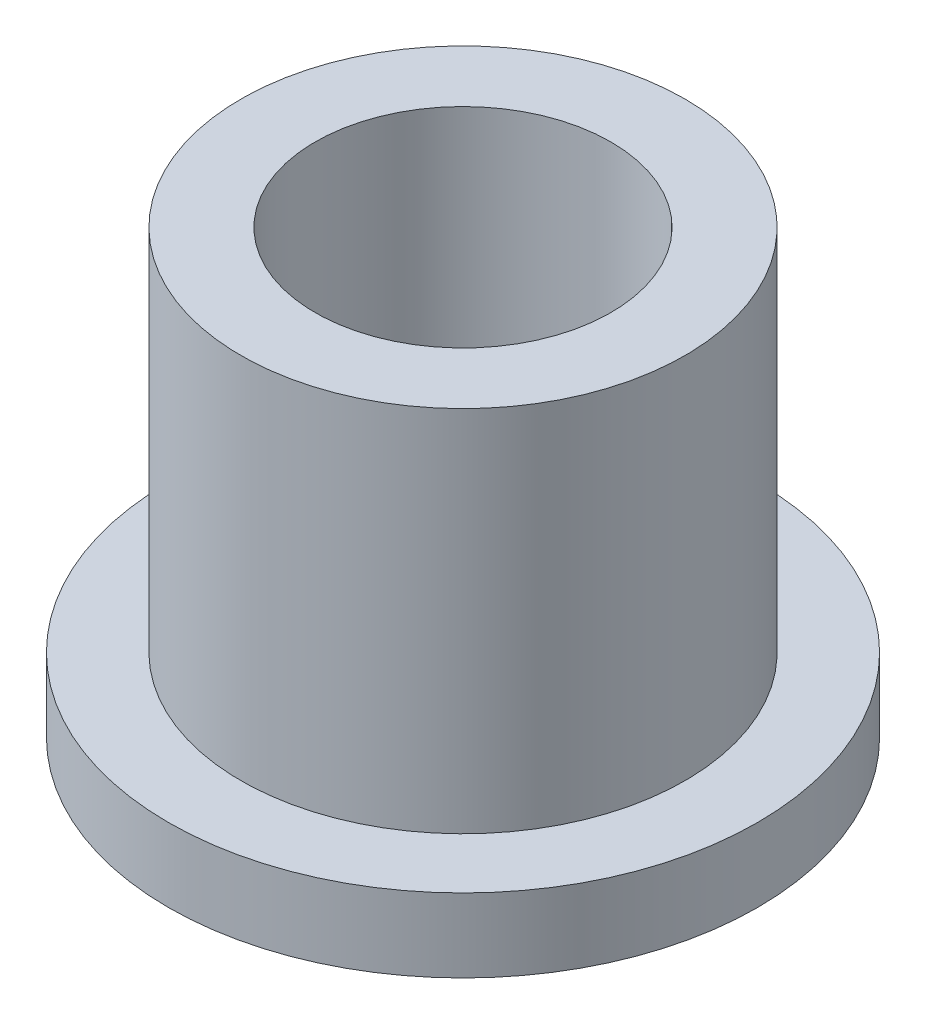
from build123d import *

# Parameters (mm, degrees)
SKETCH2_R           = 4.7879
SKETCH2_R_2         = 3.1877
BOSS_EXTRUDE1_DEPTH = 9.525
SKETCH3_R           = 6.35
SKETCH3_R_2         = 4.7879
BOSS_EXTRUDE2_DEPTH = 1.5875


with BuildPart() as part:
    # Sketch2 → Boss-Extrude1 (new body)
    with BuildSketch(Plane(origin=(0, 0, 0), x_dir=(1, 0, 0), z_dir=(0, 1, 0))):
        with Locations(Location((0, 0, 0), (0, 0, 90))):
            Circle(SKETCH2_R)
        with Locations(Location((0, 0, 0), (0, 0, 90))):
            Circle(SKETCH2_R_2, mode=Mode.SUBTRACT)
    extrude(amount=BOSS_EXTRUDE1_DEPTH)

    # Sketch3 → Boss-Extrude2 (add)
    with BuildSketch(Plane(origin=(0, 0, 0), x_dir=(1, 0, 0), z_dir=(0, 1, 0))):
        with Locations(Location((0, 0, 0), (0, 0, 270))):
            Circle(SKETCH3_R)
        with Locations(Location((0, 0, 0), (0, 0, 90))):
            Circle(SKETCH3_R_2, mode=Mode.SUBTRACT)
    extrude(amount=BOSS_EXTRUDE2_DEPTH)


solid = part.part
